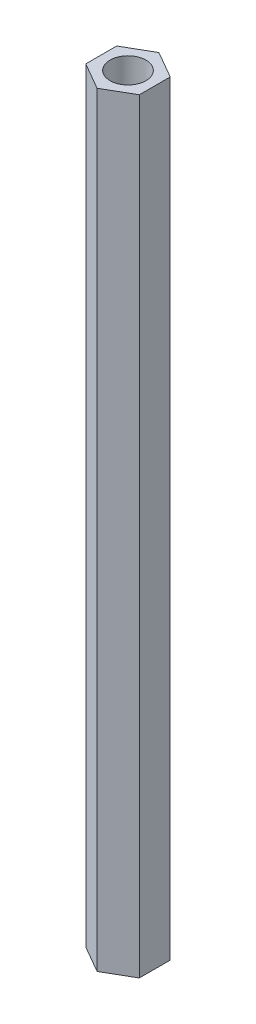
from build123d import *

# Parameters (mm, degrees)
SKETCH1_R           = 1.190625
BOSS_EXTRUDE1_DEPTH = 50.8


with BuildPart() as part:
    # Sketch1 → Boss-Extrude1 (new body)
    with BuildSketch(Plane(origin=(0, 0, 0), x_dir=(1, 0, 0), z_dir=(0, 1, 0))):
        Polygon((0, -2.053057557), (1.778, -1.026528779), (1.778, 1.026528779), (0, 2.053057557), (-1.778, 1.026528779), (-1.778, -1.026528779), align=None)
        with Locations(Location((0, 0, 0), (0, 0, 270))):
            Circle(SKETCH1_R, mode=Mode.SUBTRACT)
    extrude(amount=BOSS_EXTRUDE1_DEPTH)


solid = part.part
